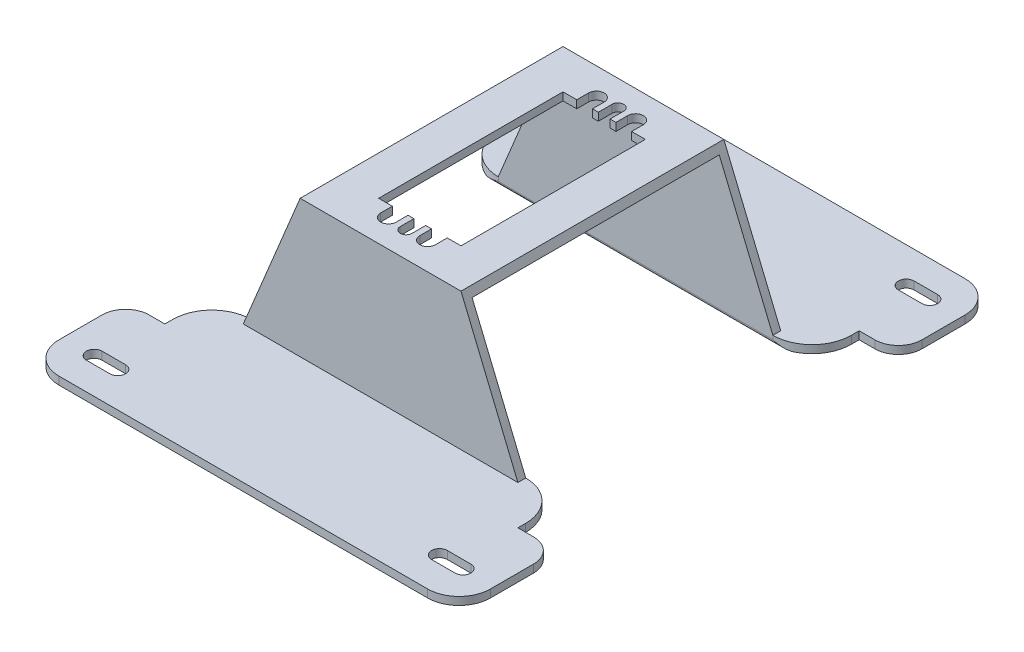
from build123d import *

# Parameters (mm, degrees)
EXTRUDE_1_DEPTH          = 2
EXTRUDE_1_2_DEPTH        = 2
EXTRUDE_3_DEPTH          = 33.5
EXTRUDE_3_DEPTH_BACK     = 33.5
CUT_EXTRUDE_3_DEPTH      = 154.195952949
CUT_EXTRUDE_3_DEPTH_BACK = 33.5
CUT_EXTRUDE_6_DEPTH      = 154.195952949


with BuildPart() as part:
    # 草图1 → 凸台-拉伸1 (new body)
    with BuildSketch(Plane(origin=(0, 0, 0), x_dir=(1, 0, 0), z_dir=(0, 1, 0))):
        with BuildLine():
            Line((0, 29), (0, 18))
            ThreePointArc((0, 18), (1.757359313, 13.757359313), (6, 12))
            Line((6, 12), (10, 12))
            Line((10, 12), (10, 10))
            ThreePointArc((10, 10), (12.928932188, 2.928932188), (20, 0))
            Line((20, 0), (90, 0))
            ThreePointArc((90, 0), (97.071067812, 2.928932188), (100, 10))
            Line((100, 10), (100, 12))
            Line((100, 12), (104, 12))
            ThreePointArc((104, 12), (108.242640687, 13.757359313), (110, 18))
            Line((110, 18), (110, 29))
            ThreePointArc((110, 29), (107.656854249, 34.656854249), (102, 37))
            Line((102, 37), (8, 37))
            ThreePointArc((8, 37), (2.343145751, 34.656854249), (0, 29))
        make_face()
        with BuildLine():
            Line((102, 30), (96, 30))
            ThreePointArc((96, 30), (94, 28), (96, 26))
            Line((96, 26), (102, 26))
            ThreePointArc((102, 26), (104, 28), (102, 30))
        make_face(mode=Mode.SUBTRACT)
        with BuildLine():
            Line((8, 26), (14, 26))
            ThreePointArc((14, 26), (16, 28), (14, 30))
            Line((14, 30), (8, 30))
            ThreePointArc((8, 30), (6, 28), (8, 26))
        make_face(mode=Mode.SUBTRACT)
    extrude(amount=EXTRUDE_1_DEPTH)



with BuildPart() as body_2:
    # 草图1 → Extrude 1 2 (new body)
    with BuildSketch(Plane(origin=(0, 0, 0), x_dir=(1, 0, 0), z_dir=(0, 1, 0))):
        with BuildLine():
            Line((100, -75), (104, -75))
            ThreePointArc((104, -75), (108.242640687, -76.757359313), (110, -81))
            Line((110, -81), (110, -92))
            ThreePointArc((110, -92), (107.656854249, -97.656854249), (102, -100))
            Line((102, -100), (8, -100))
            ThreePointArc((8, -100), (2.343145751, -97.656854249), (0, -92))
            Line((0, -92), (0, -81))
            ThreePointArc((0, -81), (1.757359313, -76.757359313), (6, -75))
            Line((6, -75), (10, -75))
            Line((10, -75), (10, -73))
            ThreePointArc((10, -73), (12.928932188, -65.928932188), (20, -63))
            Line((20, -63), (90, -63))
            ThreePointArc((90, -63), (97.071067812, -65.928932188), (100, -73))
            Line((100, -73), (100, -75))
        make_face()
        with BuildLine():
            Line((8, -93), (14, -93))
            ThreePointArc((14, -93), (16, -91), (14, -89))
            Line((14, -89), (8, -89))
            ThreePointArc((8, -89), (6, -91), (8, -93))
        make_face(mode=Mode.SUBTRACT)
        with BuildLine():
            Line((102, -89), (96, -89))
            ThreePointArc((96, -89), (94, -91), (96, -93))
            Line((96, -93), (102, -93))
            ThreePointArc((102, -93), (104, -91), (102, -89))
        make_face(mode=Mode.SUBTRACT)
    extrude(amount=EXTRUDE_1_2_DEPTH)


with BuildPart() as part_1:
    add(part.part)

    add(body_2.part)  # 凸台-拉伸3 merges body 2
    # 草图2 → 凸台-拉伸3 (add, two sides: drawn at the far end of the back side and taken through both)
    with BuildSketch(Plane.XY.offset(31.5).offset(-EXTRUDE_3_DEPTH_BACK)):
        Polygon((20, 2), (90, 2), (75.5, 37), (55, 37), (34.5, 37), align=None)
    extrude(amount=EXTRUDE_3_DEPTH + EXTRUDE_3_DEPTH_BACK)

    # 草图3 → 切除-拉伸3 (cut, two sides: drawn at the far end of the back side and taken through both)
    with BuildSketch(Plane(origin=(0, 0, 0), x_dir=(0, 0, -1), z_dir=(1, 0, 0)).offset(-CUT_EXTRUDE_3_DEPTH_BACK)):
        with BuildLine():
            Line((-63, 2), (-63, 1))
            ThreePointArc((-63, 1), (-63.292893219, 0.292893219), (-64, 0))
            Line((-64, 0), (1, 0))
            ThreePointArc((1, 0), (0.292893219, 0.292893219), (0, 1))
            Line((0, 1), (0, 2))
            Line((0, 2), (0, 35))
            Line((0, 35), (-63, 35))
            Line((-63, 35), (-63, 2))
        make_face()
    extrude(amount=CUT_EXTRUDE_3_DEPTH + CUT_EXTRUDE_3_DEPTH_BACK, mode=Mode.SUBTRACT)

    # 草图4 → 切除-拉伸6 (cut, through all)
    with BuildSketch(Plane(origin=(0, 0, 0), x_dir=(1, 0, 0), z_dir=(0, 1, 0))):
        with BuildLine():
            Line((48, -8), (44.5, -8))
            Line((44.5, -8), (44.5, -55))
            Line((44.5, -55), (48, -55))
            Line((48, -55), (48, -58))
            ThreePointArc((48, -58), (50, -60), (52, -58))
            Line((52, -58), (52, -55))
            Line((52, -55), (53.5, -55))
            Line((53.5, -55), (53.5, -58.5))
            ThreePointArc((53.5, -58.5), (55, -60), (56.5, -58.5))
            Line((56.5, -58.5), (56.5, -55))
            Line((56.5, -55), (58, -55))
            Line((58, -55), (58, -58))
            ThreePointArc((58, -58), (60, -60), (62, -58))
            Line((62, -58), (62, -55))
            Line((62, -55), (65.5, -55))
            Line((65.5, -55), (65.5, -8))
            Line((65.5, -8), (62, -8))
            Line((62, -8), (62, -5))
            ThreePointArc((62, -5), (60, -3), (58, -5))
            Line((58, -5), (58, -8))
            Line((58, -8), (56.5, -8))
            Line((56.5, -8), (56.5, -4.5))
            ThreePointArc((56.5, -4.5), (55, -3), (53.5, -4.5))
            Line((53.5, -4.5), (53.5, -8))
            Line((53.5, -8), (52, -8))
            Line((52, -8), (52, -5))
            ThreePointArc((52, -5), (50, -3), (48, -5))
            Line((48, -5), (48, -8))
        make_face()
    extrude(amount=CUT_EXTRUDE_6_DEPTH, mode=Mode.SUBTRACT)


solid = part_1.part
